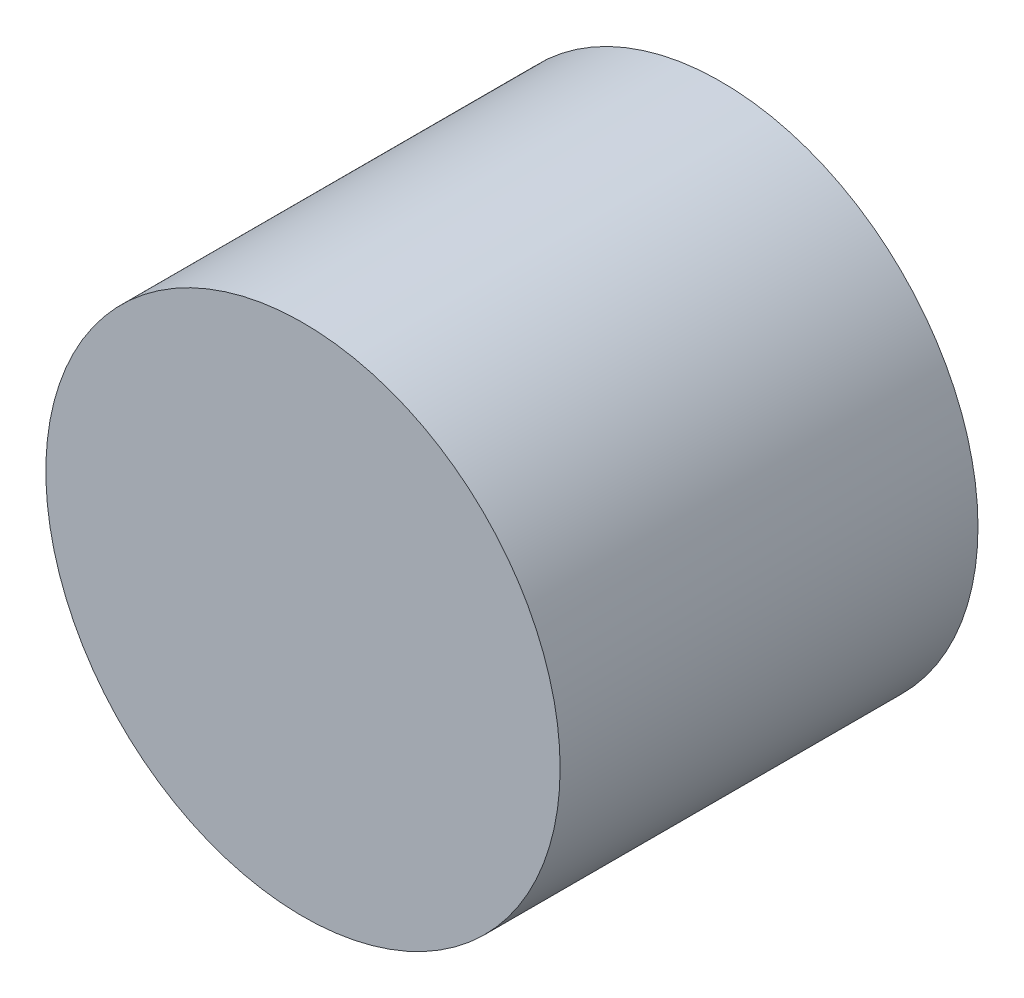
from build123d import *

# Parameters (mm, degrees)
SKETCH1_R           = 10.16
BOSS_EXTRUDE1_DEPTH = 16.51


with BuildPart() as part:
    # Sketch1 → Boss-Extrude1 (new body)
    with BuildSketch(Plane.XY):
        Circle(SKETCH1_R)
    extrude(amount=BOSS_EXTRUDE1_DEPTH)


solid = part.part
